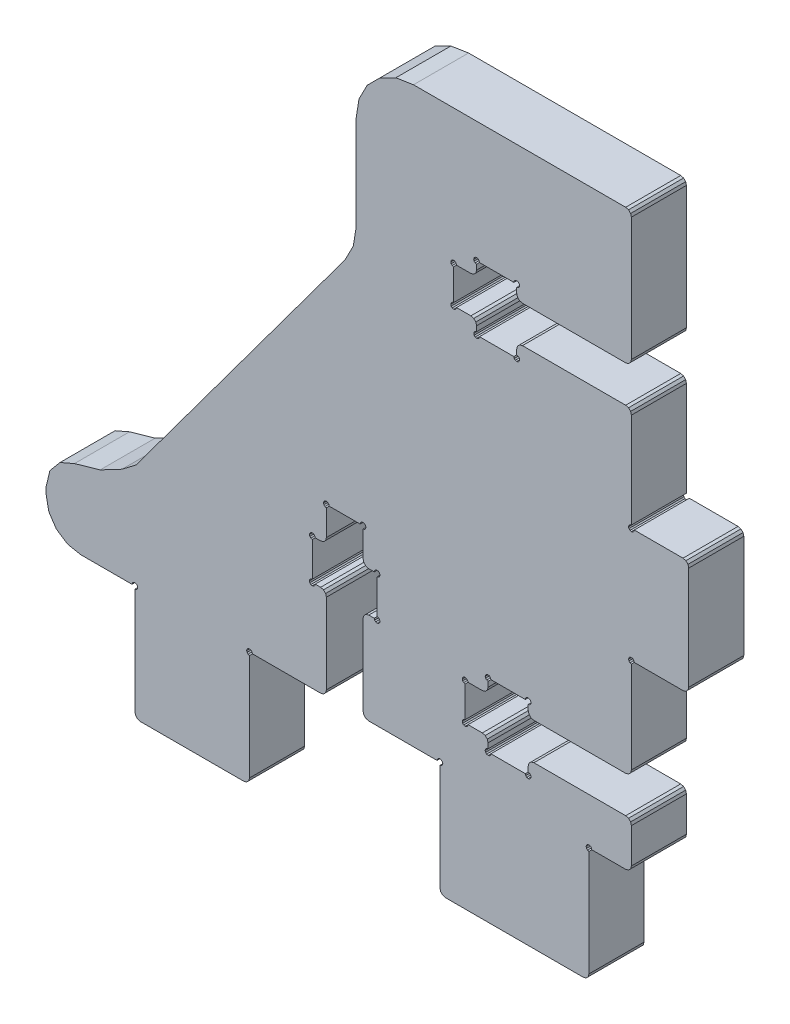
from build123d import *

# Parameters (mm, degrees)
BOSS_EXTRU_1_DEPTH = 4.8


with BuildPart() as part:
    # Esquisse1 → Boss.-Extru.1 (new body)
    with BuildSketch(Plane(origin=(0, 0, 0), x_dir=(-1, 0, 0), z_dir=(0, 0, -1))):
        Polygon((-7.835898, 19.18915), (-26.04777, 43.77774), (-26.77797, 45.18678), (-27.02983, 46.75367), (-27.02983, 55), (-27.27455, 56.54509), (-27.98475, 57.93893), (-29.09091, 59.04508), (-30.48475, 59.75528), (-32.02983, 60), (-50.52983, 60), (-50.77983, 59.93301), (-50.96284, 59.75), (-51.02983, 59.5), (-51.02983, 48.75), (-50.96284, 48.5), (-50.77983, 48.31699), (-50.52983, 48.25), (-41.52983, 48.25), (-41.27983, 48.31699), (-41.09682, 48.5), (-41.02983, 48.75), (-41.02983, 49.2), (-41.15483, 49.2335), (-41.24634, 49.325), (-41.27983, 49.45), (-41.24634, 49.575), (-41.15483, 49.66651), (-41.02983, 49.7), (-40.90483, 49.66651), (-40.81333, 49.575), (-40.77983, 49.45), (-37.77983, 49.45), (-37.74634, 49.575), (-37.65483, 49.66651), (-37.52983, 49.7), (-37.40483, 49.66651), (-37.31333, 49.575), (-37.27983, 49.45), (-37.31333, 49.325), (-37.40483, 49.2335), (-37.52983, 49.2), (-37.52983, 48.75), (-37.46284, 48.5), (-37.27983, 48.31699), (-37.02983, 48.25), (-35.77983, 48.25), (-35.74634, 48.375), (-35.65483, 48.4665), (-35.52983, 48.5), (-35.40483, 48.4665), (-35.31332, 48.375), (-35.27983, 48.25), (-35.31332, 48.125), (-35.40483, 48.03349), (-35.52983, 48), (-35.52983, 45.3), (-35.40483, 45.26651), (-35.31332, 45.175), (-35.27983, 45.05), (-35.31332, 44.925), (-35.40483, 44.8335), (-35.52983, 44.8), (-35.65483, 44.8335), (-35.74634, 44.925), (-35.77983, 45.05), (-37.02983, 45.05), (-37.27983, 44.98301), (-37.46284, 44.8), (-37.52983, 44.55), (-37.52983, 44.1), (-37.40483, 44.06651), (-37.31333, 43.975), (-37.27983, 43.85), (-37.31333, 43.725), (-37.40483, 43.63349), (-37.52983, 43.6), (-37.65483, 43.63349), (-37.74634, 43.725), (-37.77983, 43.85), (-40.77983, 43.85), (-40.81333, 43.725), (-40.90483, 43.63349), (-41.02983, 43.6), (-41.15483, 43.63349), (-41.24634, 43.725), (-41.27983, 43.85), (-41.24634, 43.975), (-41.15483, 44.06651), (-41.02983, 44.1), (-41.02983, 44.55), (-41.09682, 44.8), (-41.27983, 44.98301), (-41.52983, 45.05), (-50.52983, 45.05), (-50.77983, 44.98301), (-50.96284, 44.8), (-51.02983, 44.55), (-51.02983, 36.25), (-50.90483, 36.2165), (-50.81332, 36.125), (-50.77983, 36), (-50.81332, 35.875), (-50.90483, 35.78349), (-51.02983, 35.75), (-51.15483, 35.78349), (-51.24634, 35.875), (-51.27983, 36), (-55.52983, 36), (-55.77983, 35.93301), (-55.96284, 35.75), (-56.02983, 35.5), (-56.02983, 26.5), (-55.96284, 26.25), (-55.77983, 26.06699), (-55.52983, 26), (-51.27983, 26), (-51.24634, 26.125), (-51.15483, 26.21651), (-51.02983, 26.25), (-50.90483, 26.21651), (-50.81332, 26.125), (-50.77983, 26), (-50.81332, 25.875), (-50.90483, 25.78349), (-51.02983, 25.75), (-51.02983, 17.75), (-50.96284, 17.5), (-50.77983, 17.31699), (-50.52983, 17.25), (-42.52983, 17.25), (-42.27983, 17.31699), (-42.09682, 17.5), (-42.02983, 17.75), (-42.02983, 18.2), (-42.15483, 18.23349), (-42.24634, 18.325), (-42.27983, 18.45), (-42.24634, 18.575), (-42.15483, 18.66651), (-42.02983, 18.7), (-41.90483, 18.66651), (-41.81333, 18.575), (-41.77983, 18.45), (-38.77983, 18.45), (-38.74634, 18.575), (-38.65483, 18.66651), (-38.52983, 18.7), (-38.40483, 18.66651), (-38.31333, 18.575), (-38.27983, 18.45), (-38.31333, 18.325), (-38.40483, 18.23349), (-38.52983, 18.2), (-38.52983, 17.75), (-38.46285, 17.5), (-38.27983, 17.31699), (-38.02983, 17.25), (-36.77983, 17.25), (-36.74634, 17.375), (-36.65483, 17.46651), (-36.52983, 17.5), (-36.40483, 17.46651), (-36.31332, 17.375), (-36.27983, 17.25), (-36.31332, 17.125), (-36.40483, 17.03349), (-36.52983, 17), (-36.52983, 14.3), (-36.40483, 14.26651), (-36.31332, 14.175), (-36.27983, 14.05), (-36.31332, 13.925), (-36.40483, 13.83349), (-36.52983, 13.8), (-36.65483, 13.83349), (-36.74634, 13.925), (-36.77983, 14.05), (-38.02983, 14.05), (-38.27983, 13.98301), (-38.46285, 13.8), (-38.52983, 13.55), (-38.52983, 13.1), (-38.40483, 13.06651), (-38.31333, 12.975), (-38.27983, 12.85), (-38.31333, 12.725), (-38.40483, 12.63349), (-38.52983, 12.6), (-38.65483, 12.63349), (-38.74634, 12.725), (-38.77983, 12.85), (-41.77983, 12.85), (-41.81333, 12.725), (-41.90483, 12.63349), (-42.02983, 12.6), (-42.15483, 12.63349), (-42.24634, 12.725), (-42.27983, 12.85), (-42.24634, 12.975), (-42.15483, 13.06651), (-42.02983, 13.1), (-42.02983, 13.55), (-42.09682, 13.8), (-42.27983, 13.98301), (-42.52983, 14.05), (-50.52983, 14.05), (-50.77983, 13.98301), (-50.96284, 13.8), (-51.02983, 13.55), (-51.02983, 10.5), (-50.96284, 10.25), (-50.77983, 10.06699), (-50.52983, 10), (-47.57983, 10), (-47.54634, 10.125), (-47.45483, 10.21651), (-47.32983, 10.25), (-47.20483, 10.21651), (-47.11333, 10.125), (-47.07983, 10), (-47.11333, 9.875), (-47.20483, 9.783493), (-47.32983, 9.75), (-47.32983, 0.5000001), (-47.26285, 0.2499996), (-47.07983, 0.06698724), (-46.82983, 0), (-34.82983, 0), (-34.57983, 0.06698724), (-34.39682, 0.2499996), (-34.32983, 0.5000001), (-34.32983, 9.75), (-34.45483, 9.783493), (-34.54634, 9.875), (-34.57983, 10), (-34.54634, 10.125), (-34.45483, 10.21651), (-34.32983, 10.25), (-34.20483, 10.21651), (-34.11333, 10.125), (-34.07983, 10), (-28.12983, 10), (-27.87983, 10.06699), (-27.69682, 10.25), (-27.62983, 10.5), (-27.62983, 17.5), (-27.69682, 17.75), (-27.87983, 17.93301), (-28.12983, 18), (-28.60483, 18), (-28.63832, 17.875), (-28.72983, 17.78349), (-28.85483, 17.75), (-28.97983, 17.78349), (-29.07134, 17.875), (-29.10483, 18), (-29.07134, 18.125), (-28.97983, 18.21651), (-28.85483, 18.25), (-28.85483, 21.25), (-28.97983, 21.28349), (-29.07134, 21.375), (-29.10483, 21.5), (-29.07134, 21.625), (-28.97983, 21.71651), (-28.85483, 21.75), (-28.72983, 21.71651), (-28.63832, 21.625), (-28.60483, 21.5), (-28.12983, 21.5), (-27.87983, 21.56699), (-27.69682, 21.75), (-27.62983, 22), (-27.62983, 24.25), (-27.75483, 24.28349), (-27.84634, 24.375), (-27.87983, 24.5), (-27.84634, 24.625), (-27.75483, 24.71651), (-27.62983, 24.75), (-27.50483, 24.71651), (-27.41333, 24.625), (-27.37983, 24.5), (-24.67983, 24.5), (-24.64634, 24.625), (-24.55483, 24.71651), (-24.42983, 24.75), (-24.30483, 24.71651), (-24.21333, 24.625), (-24.17983, 24.5), (-24.21333, 24.375), (-24.30483, 24.28349), (-24.42983, 24.25), (-24.42983, 22), (-24.36284, 21.75), (-24.17983, 21.56699), (-23.92983, 21.5), (-23.45483, 21.5), (-23.42134, 21.625), (-23.32983, 21.71651), (-23.20483, 21.75), (-23.07983, 21.71651), (-22.98833, 21.625), (-22.95483, 21.5), (-22.98833, 21.375), (-23.07983, 21.28349), (-23.20483, 21.25), (-23.20483, 18.25), (-23.07983, 18.21651), (-22.98833, 18.125), (-22.95483, 18), (-22.98833, 17.875), (-23.07983, 17.78349), (-23.20483, 17.75), (-23.32983, 17.78349), (-23.42134, 17.875), (-23.45483, 18), (-23.92983, 18), (-24.17983, 17.93301), (-24.36284, 17.75), (-24.42983, 17.5), (-24.42983, 10.5), (-24.36284, 10.25), (-24.17983, 10.06699), (-23.92983, 10), (-17.97983, 10), (-17.94634, 10.125), (-17.85483, 10.21651), (-17.72983, 10.25), (-17.60483, 10.21651), (-17.51332, 10.125), (-17.47983, 10), (-17.51332, 9.875), (-17.60483, 9.783493), (-17.72983, 9.75), (-17.72983, 0.5000001), (-17.66285, 0.2499996), (-17.47983, 0.06698724), (-17.22983, 0), (-8.229832, 0), (-7.979833, 0.06698724), (-7.79682, 0.2499996), (-7.729832, 0.5000001), (-7.729832, 9.75), (-7.854832, 9.783493), (-7.946339, 9.875), (-7.979833, 10), (-7.946339, 10.125), (-7.854832, 10.21651), (-7.729832, 10.25), (-7.604832, 10.21651), (-7.513326, 10.125), (-7.479833, 10), (-3, 10), (-1.85195, 10.22836), (-0.8786796, 10.87868), (-0.2283613, 11.85195), (0, 13), (0, 13.65786), (-0.3172806, 15.00063), (-1.202011, 16.05937), (-2.467053, 16.61014), (-4.701942, 17.25093), (-6.605887, 18.25413), align=None)
    extrude(amount=-BOSS_EXTRU_1_DEPTH)


solid = part.part
